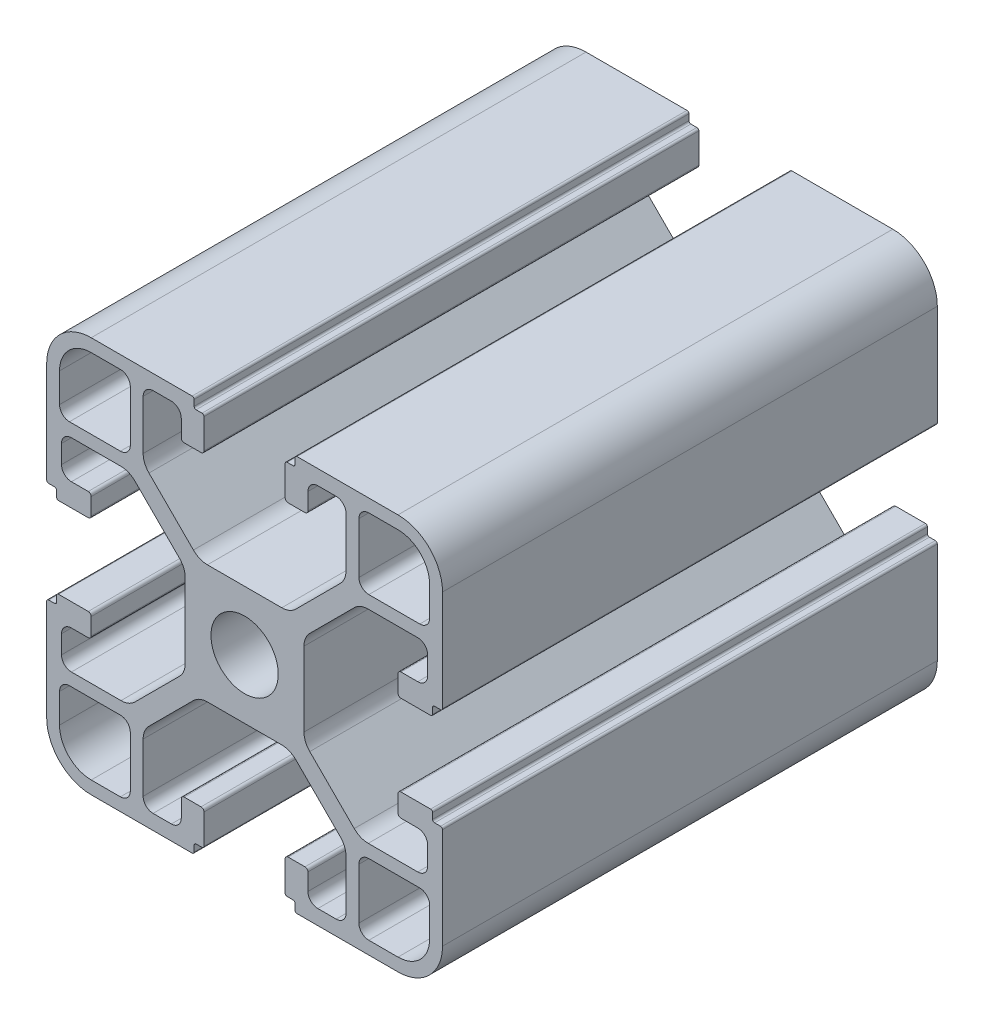
from build123d import *

# Parameters (mm, degrees)
SKETCH2_R           = 3.4
BOSS_EXTRUDE1_DEPTH = 50


with BuildPart() as part:
    # Sketch2 → Boss-Extrude1 (new body)
    with BuildSketch(Plane.XY):
        with BuildLine():
            Line((4.5, 0), (14.7, 0))
            ThreePointArc((14.7, 0), (14.841421356, 0.058578644), (14.9, 0.2))
            Line((14.9, 0.2), (14.9, 0.8))
            ThreePointArc((14.9, 0.8), (14.958578644, 0.941421356), (15.1, 1))
            Line((15.1, 1), (15.7, 1))
            ThreePointArc((15.7, 1), (15.841421356, 1.058578644), (15.9, 1.2))
            Line((15.9, 1.2), (15.9, 4.2))
            ThreePointArc((15.9, 4.2), (15.812132034, 4.412132034), (15.6, 4.5))
            Line((15.6, 4.5), (13.9, 4.5))
            ThreePointArc((13.9, 4.5), (13.687867966, 4.412132034), (13.6, 4.2))
            Line((13.6, 4.2), (13.6, 2.5))
            ThreePointArc((13.6, 2.5), (13.307106781, 1.792893219), (12.6, 1.5))
            Line((12.6, 1.5), (10.75, 1.5))
            ThreePointArc((10.75, 1.5), (10.042893219, 1.792893219), (9.75, 2.5))
            Line((9.75, 2.5), (9.75, 7.507359313))
            ThreePointArc((9.75, 7.507359313), (9.902240935, 8.272726178), (10.335786438, 8.921572875))
            Line((10.335786438, 8.921572875), (14.828427125, 13.414213562))
            ThreePointArc((14.828427125, 13.414213562), (15.477273822, 13.847759065), (16.242640687, 14))
            Line((16.242640687, 14), (23.757359313, 14))
            ThreePointArc((23.757359313, 14), (24.522726178, 13.847759065), (25.171572875, 13.414213562))
            Line((25.171572875, 13.414213562), (29.664213562, 8.921572875))
            ThreePointArc((29.664213562, 8.921572875), (30.097759065, 8.272726178), (30.25, 7.507359313))
            Line((30.25, 7.507359313), (30.25, 2.5))
            ThreePointArc((30.25, 2.5), (29.957106781, 1.792893219), (29.25, 1.5))
            Line((29.25, 1.5), (27.4, 1.5))
            ThreePointArc((27.4, 1.5), (26.692893219, 1.792893219), (26.4, 2.5))
            Line((26.4, 2.5), (26.4, 4.2))
            ThreePointArc((26.4, 4.2), (26.312132034, 4.412132034), (26.1, 4.5))
            Line((26.1, 4.5), (24.4, 4.5))
            ThreePointArc((24.4, 4.5), (24.187867966, 4.412132034), (24.1, 4.2))
            Line((24.1, 4.2), (24.1, 1.2))
            ThreePointArc((24.1, 1.2), (24.158578644, 1.058578644), (24.3, 1))
            Line((24.3, 1), (24.9, 1))
            ThreePointArc((24.9, 1), (25.041421356, 0.941421356), (25.1, 0.8))
            Line((25.1, 0.8), (25.1, 0.2))
            ThreePointArc((25.1, 0.2), (25.158578644, 0.058578644), (25.3, 0))
            Line((25.3, 0), (35.5, 0))
            ThreePointArc((35.5, 0), (38.681980515, 1.318019485), (40, 4.5))
            Line((40, 4.5), (40, 14.7))
            ThreePointArc((40, 14.7), (39.941421356, 14.841421356), (39.8, 14.9))
            Line((39.8, 14.9), (39.2, 14.9))
            ThreePointArc((39.2, 14.9), (39.058578644, 14.958578644), (39, 15.1))
            Line((39, 15.1), (39, 15.7))
            ThreePointArc((39, 15.7), (38.941421356, 15.841421356), (38.8, 15.9))
            Line((38.8, 15.9), (35.8, 15.9))
            ThreePointArc((35.8, 15.9), (35.587867966, 15.812132034), (35.5, 15.6))
            Line((35.5, 15.6), (35.5, 13.9))
            ThreePointArc((35.5, 13.9), (35.587867966, 13.687867966), (35.8, 13.6))
            Line((35.8, 13.6), (37.5, 13.6))
            ThreePointArc((37.5, 13.6), (38.207106781, 13.307106781), (38.5, 12.6))
            Line((38.5, 12.6), (38.5, 10.75))
            ThreePointArc((38.5, 10.75), (38.207106781, 10.042893219), (37.5, 9.75))
            Line((37.5, 9.75), (32.492640687, 9.75))
            ThreePointArc((32.492640687, 9.75), (31.727273822, 9.902240935), (31.078427125, 10.335786438))
            Line((31.078427125, 10.335786438), (26.585786438, 14.828427125))
            ThreePointArc((26.585786438, 14.828427125), (26.152240935, 15.477273822), (26, 16.242640687))
            Line((26, 16.242640687), (26, 23.757359313))
            ThreePointArc((26, 23.757359313), (26.152240935, 24.522726178), (26.585786438, 25.171572875))
            Line((26.585786438, 25.171572875), (31.078427125, 29.664213562))
            ThreePointArc((31.078427125, 29.664213562), (31.727273822, 30.097759065), (32.492640687, 30.25))
            Line((32.492640687, 30.25), (37.5, 30.25))
            ThreePointArc((37.5, 30.25), (38.207106781, 29.957106781), (38.5, 29.25))
            Line((38.5, 29.25), (38.5, 27.4))
            ThreePointArc((38.5, 27.4), (38.207106781, 26.692893219), (37.5, 26.4))
            Line((37.5, 26.4), (35.8, 26.4))
            ThreePointArc((35.8, 26.4), (35.587867966, 26.312132034), (35.5, 26.1))
            Line((35.5, 26.1), (35.5, 24.4))
            ThreePointArc((35.5, 24.4), (35.587867966, 24.187867966), (35.8, 24.1))
            Line((35.8, 24.1), (38.8, 24.1))
            ThreePointArc((38.8, 24.1), (38.941421356, 24.158578644), (39, 24.3))
            Line((39, 24.3), (39, 24.9))
            ThreePointArc((39, 24.9), (39.058578644, 25.041421356), (39.2, 25.1))
            Line((39.2, 25.1), (39.8, 25.1))
            ThreePointArc((39.8, 25.1), (39.941421356, 25.158578644), (40, 25.3))
            Line((40, 25.3), (40, 35.5))
            ThreePointArc((40, 35.5), (38.681980515, 38.681980515), (35.5, 40))
            Line((35.5, 40), (25.3, 40))
            ThreePointArc((25.3, 40), (25.158578644, 39.941421356), (25.1, 39.8))
            Line((25.1, 39.8), (25.1, 39.2))
            ThreePointArc((25.1, 39.2), (25.041421356, 39.058578644), (24.9, 39))
            Line((24.9, 39), (24.3, 39))
            ThreePointArc((24.3, 39), (24.158578644, 38.941421356), (24.1, 38.8))
            Line((24.1, 38.8), (24.1, 35.8))
            ThreePointArc((24.1, 35.8), (24.187867966, 35.587867966), (24.4, 35.5))
            Line((24.4, 35.5), (26.1, 35.5))
            ThreePointArc((26.1, 35.5), (26.312132034, 35.587867966), (26.4, 35.8))
            Line((26.4, 35.8), (26.4, 37.5))
            ThreePointArc((26.4, 37.5), (26.692893219, 38.207106781), (27.4, 38.5))
            Line((27.4, 38.5), (29.25, 38.5))
            ThreePointArc((29.25, 38.5), (29.957106781, 38.207106781), (30.25, 37.5))
            Line((30.25, 37.5), (30.25, 32.492640687))
            ThreePointArc((30.25, 32.492640687), (30.097759065, 31.727273822), (29.664213562, 31.078427125))
            Line((29.664213562, 31.078427125), (25.171572875, 26.585786438))
            ThreePointArc((25.171572875, 26.585786438), (24.522726178, 26.152240935), (23.757359313, 26))
            Line((23.757359313, 26), (16.242640687, 26))
            ThreePointArc((16.242640687, 26), (15.477273822, 26.152240935), (14.828427125, 26.585786438))
            Line((14.828427125, 26.585786438), (10.335786438, 31.078427125))
            ThreePointArc((10.335786438, 31.078427125), (9.902240935, 31.727273822), (9.75, 32.492640687))
            Line((9.75, 32.492640687), (9.75, 37.5))
            ThreePointArc((9.75, 37.5), (10.042893219, 38.207106781), (10.75, 38.5))
            Line((10.75, 38.5), (12.6, 38.5))
            ThreePointArc((12.6, 38.5), (13.307106781, 38.207106781), (13.6, 37.5))
            Line((13.6, 37.5), (13.6, 35.8))
            ThreePointArc((13.6, 35.8), (13.687867966, 35.587867966), (13.9, 35.5))
            Line((13.9, 35.5), (15.6, 35.5))
            ThreePointArc((15.6, 35.5), (15.812132034, 35.587867966), (15.9, 35.8))
            Line((15.9, 35.8), (15.9, 38.8))
            ThreePointArc((15.9, 38.8), (15.841421356, 38.941421356), (15.7, 39))
            Line((15.7, 39), (15.1, 39))
            ThreePointArc((15.1, 39), (14.958578644, 39.058578644), (14.9, 39.2))
            Line((14.9, 39.2), (14.9, 39.8))
            ThreePointArc((14.9, 39.8), (14.841421356, 39.941421356), (14.7, 40))
            Line((14.7, 40), (4.5, 40))
            ThreePointArc((4.5, 40), (1.318019485, 38.681980515), (0, 35.5))
            Line((0, 35.5), (0, 25.3))
            ThreePointArc((0, 25.3), (0.058578644, 25.158578644), (0.2, 25.1))
            Line((0.2, 25.1), (0.8, 25.1))
            ThreePointArc((0.8, 25.1), (0.941421356, 25.041421356), (1, 24.9))
            Line((1, 24.9), (1, 24.3))
            ThreePointArc((1, 24.3), (1.058578644, 24.158578644), (1.2, 24.1))
            Line((1.2, 24.1), (4.2, 24.1))
            ThreePointArc((4.2, 24.1), (4.412132034, 24.187867966), (4.5, 24.4))
            Line((4.5, 24.4), (4.5, 26.1))
            ThreePointArc((4.5, 26.1), (4.412132034, 26.312132034), (4.2, 26.4))
            Line((4.2, 26.4), (2.5, 26.4))
            ThreePointArc((2.5, 26.4), (1.792893219, 26.692893219), (1.5, 27.4))
            Line((1.5, 27.4), (1.5, 29.25))
            ThreePointArc((1.5, 29.25), (1.792893219, 29.957106781), (2.5, 30.25))
            Line((2.5, 30.25), (7.507359313, 30.25))
            ThreePointArc((7.507359313, 30.25), (8.272726178, 30.097759065), (8.921572875, 29.664213562))
            Line((8.921572875, 29.664213562), (13.414213562, 25.171572875))
            ThreePointArc((13.414213562, 25.171572875), (13.847759065, 24.522726178), (14, 23.757359313))
            Line((14, 23.757359313), (14, 16.242640687))
            ThreePointArc((14, 16.242640687), (13.847759065, 15.477273822), (13.414213562, 14.828427125))
            Line((13.414213562, 14.828427125), (8.921572875, 10.335786438))
            ThreePointArc((8.921572875, 10.335786438), (8.272726178, 9.902240935), (7.507359313, 9.75))
            Line((7.507359313, 9.75), (2.5, 9.75))
            ThreePointArc((2.5, 9.75), (1.792893219, 10.042893219), (1.5, 10.75))
            Line((1.5, 10.75), (1.5, 12.6))
            ThreePointArc((1.5, 12.6), (1.792893219, 13.307106781), (2.5, 13.6))
            Line((2.5, 13.6), (4.2, 13.6))
            ThreePointArc((4.2, 13.6), (4.412132034, 13.687867966), (4.5, 13.9))
            Line((4.5, 13.9), (4.5, 15.6))
            ThreePointArc((4.5, 15.6), (4.412132034, 15.812132034), (4.2, 15.9))
            Line((4.2, 15.9), (1.2, 15.9))
            ThreePointArc((1.2, 15.9), (1.058578644, 15.841421356), (1, 15.7))
            Line((1, 15.7), (1, 15.1))
            ThreePointArc((1, 15.1), (0.941421356, 14.958578644), (0.8, 14.9))
            Line((0.8, 14.9), (0.2, 14.9))
            ThreePointArc((0.2, 14.9), (0.058578644, 14.841421356), (0, 14.7))
            Line((0, 14.7), (0, 4.5))
            ThreePointArc((0, 4.5), (1.318019485, 1.318019485), (4.5, 0))
        make_face()
        with Locations((20, 20)):
            Circle(SKETCH2_R, mode=Mode.SUBTRACT)
        with BuildLine():
            Line((31.55, 37.7), (31.55, 32.55))
            ThreePointArc((31.55, 32.55), (31.842893219, 31.842893219), (32.55, 31.55))
            Line((32.55, 31.55), (37.7, 31.55))
            ThreePointArc((37.7, 31.55), (38.407106781, 31.842893219), (38.7, 32.55))
            Line((38.7, 32.55), (38.7, 35.5))
            ThreePointArc((38.7, 35.5), (37.7627417, 37.7627417), (35.5, 38.7))
            Line((35.5, 38.7), (32.55, 38.7))
            ThreePointArc((32.55, 38.7), (31.842893219, 38.407106781), (31.55, 37.7))
        make_face(mode=Mode.SUBTRACT)
        with BuildLine():
            Line((1.3, 35.5), (1.3, 32.55))
            ThreePointArc((1.3, 32.55), (1.592893219, 31.842893219), (2.3, 31.55))
            Line((2.3, 31.55), (7.45, 31.55))
            ThreePointArc((7.45, 31.55), (8.157106781, 31.842893219), (8.45, 32.55))
            Line((8.45, 32.55), (8.45, 37.7))
            ThreePointArc((8.45, 37.7), (8.157106781, 38.407106781), (7.45, 38.7))
            Line((7.45, 38.7), (4.5, 38.7))
            ThreePointArc((4.5, 38.7), (2.2372583, 37.7627417), (1.3, 35.5))
        make_face(mode=Mode.SUBTRACT)
        with BuildLine():
            Line((1.3, 7.45), (1.3, 4.5))
            ThreePointArc((1.3, 4.5), (2.2372583, 2.2372583), (4.5, 1.3))
            Line((4.5, 1.3), (7.45, 1.3))
            ThreePointArc((7.45, 1.3), (8.157106781, 1.592893219), (8.45, 2.3))
            Line((8.45, 2.3), (8.45, 7.45))
            ThreePointArc((8.45, 7.45), (8.157106781, 8.157106781), (7.45, 8.45))
            Line((7.45, 8.45), (2.3, 8.45))
            ThreePointArc((2.3, 8.45), (1.592893219, 8.157106781), (1.3, 7.45))
        make_face(mode=Mode.SUBTRACT)
        with BuildLine():
            Line((31.55, 7.45), (31.55, 2.3))
            ThreePointArc((31.55, 2.3), (31.842893219, 1.592893219), (32.55, 1.3))
            Line((32.55, 1.3), (35.5, 1.3))
            ThreePointArc((35.5, 1.3), (37.7627417, 2.2372583), (38.7, 4.5))
            Line((38.7, 4.5), (38.7, 7.45))
            ThreePointArc((38.7, 7.45), (38.407106781, 8.157106781), (37.7, 8.45))
            Line((37.7, 8.45), (32.55, 8.45))
            ThreePointArc((32.55, 8.45), (31.842893219, 8.157106781), (31.55, 7.45))
        make_face(mode=Mode.SUBTRACT)
    extrude(amount=BOSS_EXTRUDE1_DEPTH)


solid = part.part
